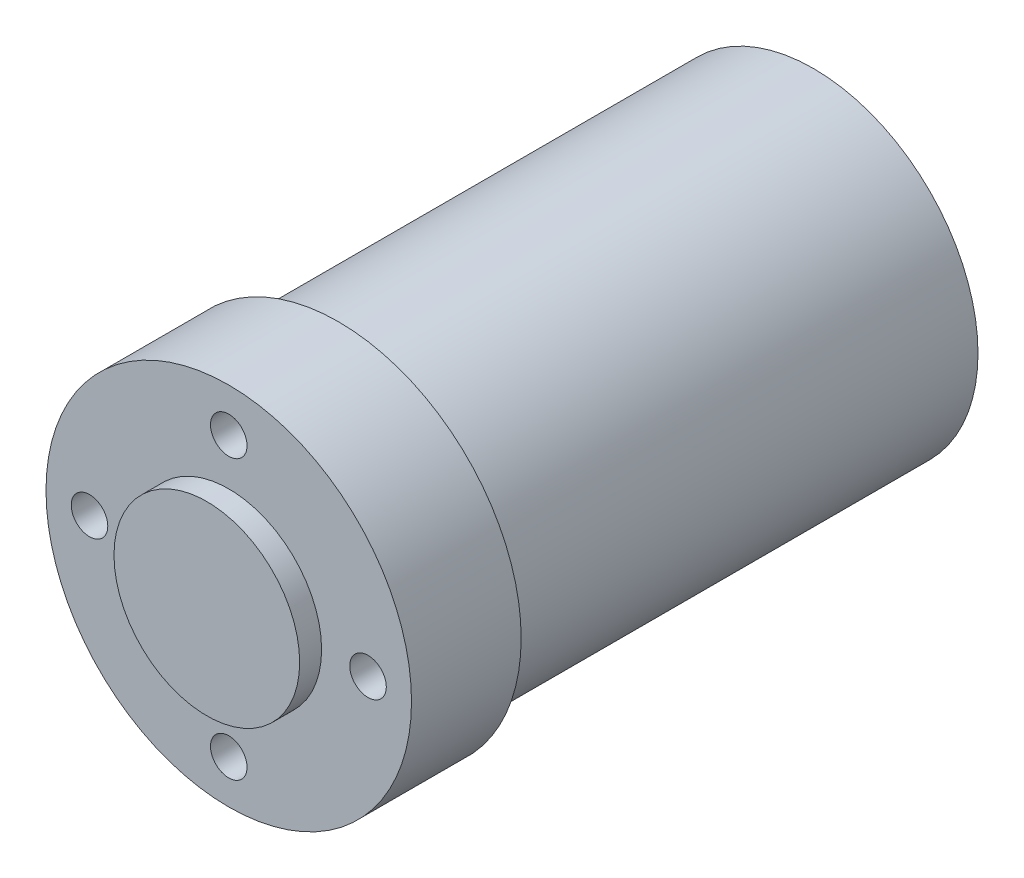
from build123d import *

# Parameters (mm, degrees)
SKETCH1_W                  = 25
SKETCH1_H                  = 15
SKETCH2_R                  = 12.7
BOSS_EXTRUDE1_DEPTH        = 3
SKETCH3_R                  = 22.4917
BOSS_EXTRUDE2_DEPTH        = 65
F_10_CLEARANCE_HOLE1_D     = 5
F_10_CLEARANCE_HOLE1_DEPTH = 8
F_10_CLEARANCE_HOLE2_D     = 5
F_10_CLEARANCE_HOLE2_DEPTH = 12.446


with BuildPart() as part:
    # Sketch1 → Revolve1 (revolve)
    with BuildSketch(Plane.XZ, mode=Mode.PRIVATE) as revolve1_sk:
        with Locations((12.5, 72.5)):
            Rectangle(SKETCH1_W, SKETCH1_H)
    revolve(revolve1_sk.sketch.rotate(Axis((0, 0, 80), (0, 0, -1)), 180), axis=Axis((0, 0, 80), (0, 0, -1)))

    # Sketch2 → Boss-Extrude1 (add)
    with BuildSketch(Plane.XY.offset(80)):
        Circle(SKETCH2_R)
    extrude(amount=BOSS_EXTRUDE1_DEPTH)

    # Sketch3 → Boss-Extrude2 (add)
    with BuildSketch(Plane(origin=(0, 0, 65), x_dir=(-1, 0, 0), z_dir=(0, 0, -1))):
        Circle(SKETCH3_R)
    extrude(amount=BOSS_EXTRUDE2_DEPTH)

    # #10 Clearance Hole1
    with Locations(Plane(origin=(0, 0, 0), x_dir=(-1, 0, 0), z_dir=(0, 0, -1))):
        with Locations((-12.374368671, 12.374368671), (-17.5, 0), (-12.374368671, -12.374368671), (0, -17.5), (12.374368671, -12.374368671), (17.5, 0), (12.374368671, 12.374368671), (0, 17.5)):
            Hole(F_10_CLEARANCE_HOLE1_D / 2, depth=F_10_CLEARANCE_HOLE1_DEPTH)

    # #10 Clearance Hole2
    with Locations(Plane.XY.offset(80)):
        with Locations((-19.05, 0), (0, -19.05), (19.05, 0), (0, 19.05)):
            Hole(F_10_CLEARANCE_HOLE2_D / 2, depth=F_10_CLEARANCE_HOLE2_DEPTH)


solid = part.part
